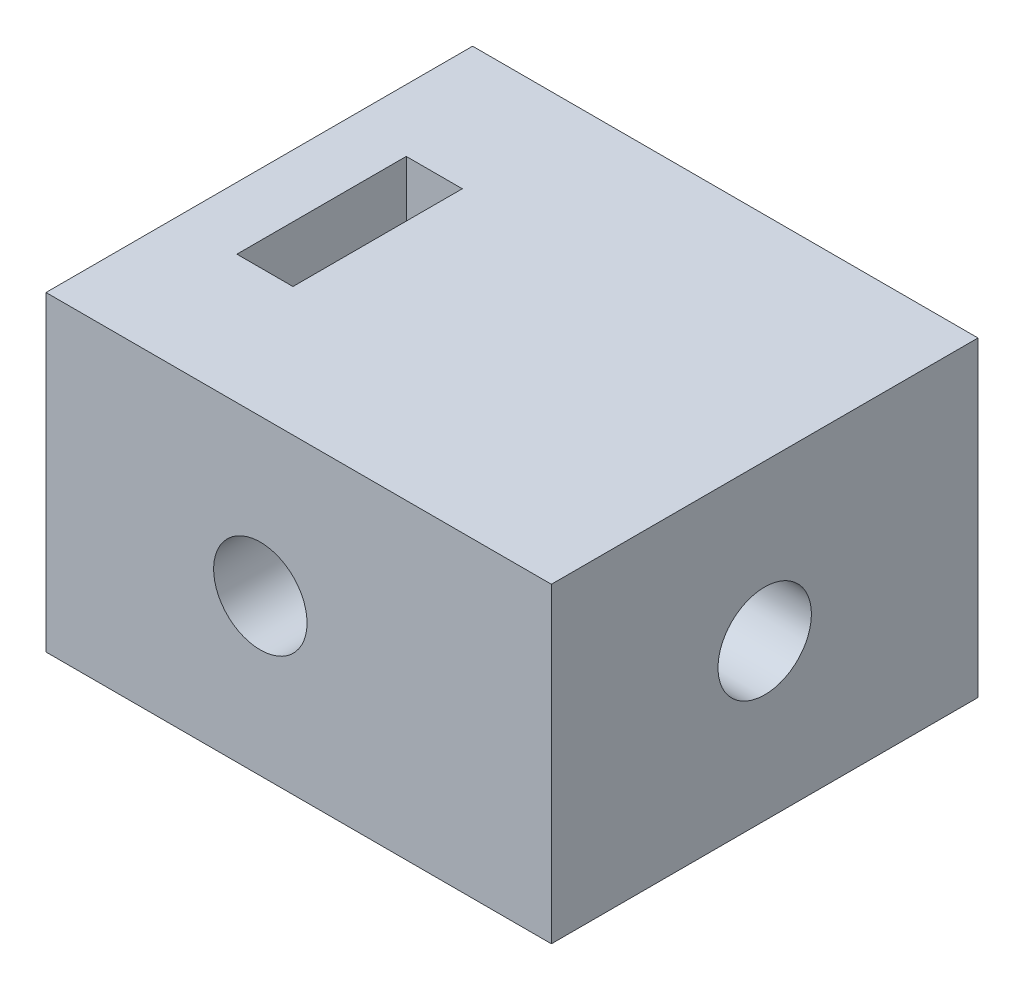
from build123d import *

# Parameters (mm, degrees)
SKETCH2_W           = 16.23
SKETCH2_H           = 10
SKETCH2_R           = 1.5
BOSS_EXTRUDE1_DEPTH = 13.7
SKETCH3_R           = 1.5
CUT_EXTRUDE1_DEPTH  = 24.47558093
CUT_EXTRUDE4_DEPTH  = 1.8
SKETCH7_W           = 1.8
SKETCH7_H           = 5.438639536
CUT_EXTRUDE5_DEPTH  = 5
SKETCH8_W           = 1.8
SKETCH8_H           = 2.719319768
CUT_EXTRUDE6_DEPTH  = 23.476630642


with BuildPart() as part:
    # Sketch2 → Boss-Extrude1 (new body)
    with BuildSketch(Plane.XY):
        with Locations((8.115, 5)):
            Rectangle(SKETCH2_W, SKETCH2_H)
        with Locations(Location((6.882853167, 5, 0), (0, 0, 180))):
            Circle(SKETCH2_R, mode=Mode.SUBTRACT)
    extrude(amount=BOSS_EXTRUDE1_DEPTH)

    # Sketch3 → Cut-Extrude1 (cut, through all)
    with BuildSketch(Plane(origin=(16.23, 0, 0), x_dir=(0, 0, -1), z_dir=(1, 0, 0))):
        with Locations((-6.85, 5)):
            Circle(SKETCH3_R)
    extrude(amount=-CUT_EXTRUDE1_DEPTH, mode=Mode.SUBTRACT)

    # Sketch4 → Cut-Extrude4 (cut)
    with BuildSketch(Plane(origin=(2, 0, 0), x_dir=(0, 0, -1), z_dir=(1, 0, 0))):
        Polygon((-5.490340116, 2.645), (-4.130680232, 5), (-5.490340116, 7.355), (-8.209659884, 7.355), (-9.569319768, 5), (-8.209659884, 2.645), align=None)
    extrude(amount=CUT_EXTRUDE4_DEPTH, mode=Mode.SUBTRACT)

    # Sketch7 → Cut-Extrude5 (cut)
    with BuildSketch(Plane(origin=(0, 10, 0), x_dir=(1, 0, 0), z_dir=(0, 1, 0))):
        with Locations((2.9, -6.85)):
            Rectangle(SKETCH7_W, SKETCH7_H)
    extrude(amount=-CUT_EXTRUDE5_DEPTH, mode=Mode.SUBTRACT)

    # Sketch8 → Cut-Extrude6 (cut, through all)
    with BuildSketch(Plane(origin=(0, 2.645, 0), x_dir=(1, 0, 0), z_dir=(0, 1, 0))):
        with Locations((2.9, -6.85)):
            Rectangle(SKETCH8_W, SKETCH8_H)
    extrude(amount=-CUT_EXTRUDE6_DEPTH, mode=Mode.SUBTRACT)


solid = part.part
